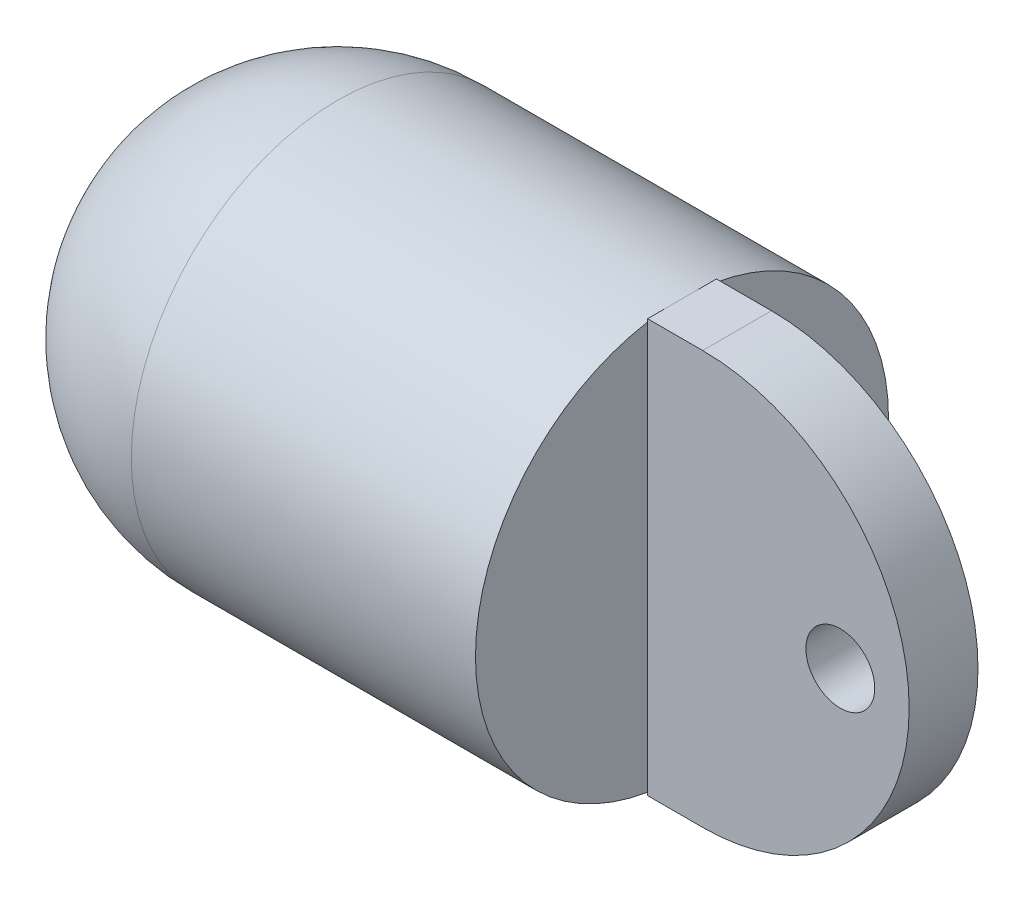
from build123d import *

# Parameters (mm, degrees)
SKETCH2_R               = 15
BOSS_EXTRUDE1_DEPTH     = 25
SKETCH7_W               = 5
SKETCH7_H               = 30
BOSS_EXTRUDE2_DEPTH     = 4
BOSS_EXTRUDE3_DEPTH     = 5
CUT_EXTRUDE3_DEPTH      = 35.003676272
CUT_EXTRUDE3_DEPTH_BACK = 35.003676272
SKETCH9_R               = 2.5


with BuildPart() as part:
    # Sketch2 → Boss-Extrude1 (new body)
    with BuildSketch(Plane(origin=(0, 0, 0), x_dir=(0, 0, -1), z_dir=(1, 0, 0))):
        Circle(SKETCH2_R)
    extrude(amount=-BOSS_EXTRUDE1_DEPTH)

    # Sketch7 → Boss-Extrude2 (add)
    with BuildSketch(Plane(origin=(0, 0, 0), x_dir=(0, 0, -1), z_dir=(1, 0, 0))):
        Rectangle(SKETCH7_W, SKETCH7_H)
    extrude(amount=BOSS_EXTRUDE2_DEPTH)

    # Sketch8 → Boss-Extrude3 (add)
    with BuildSketch(Plane.XY.offset(2.5)):
        with BuildLine():
            Line((4, 15), (4, -15))
            ThreePointArc((4, -15), (19, 0), (4, 15))
        make_face()
    extrude(amount=-BOSS_EXTRUDE3_DEPTH)

    # Sketch9 → Cut-Extrude3 (cut, two sides: drawn at the far end of the back side and taken through both)
    with BuildSketch(Plane.XY.offset(2.5).offset(-CUT_EXTRUDE3_DEPTH_BACK)):
        with Locations(Location((14, 0, 0), (0, 0, 270))):
            Circle(SKETCH9_R)
    extrude(amount=CUT_EXTRUDE3_DEPTH + CUT_EXTRUDE3_DEPTH_BACK, mode=Mode.SUBTRACT)

    # Sketch10 → Revolve1 (revolve)
    with BuildSketch(Plane.ZY.offset(25)):
        with BuildLine():
            Line((0, 15), (0, -15))
            ThreePointArc((0, -15), (15, 0), (0, 15))
        make_face()
    revolve(axis=Axis((-25, 15, 0), (0, -1, 0)))


solid = part.part
